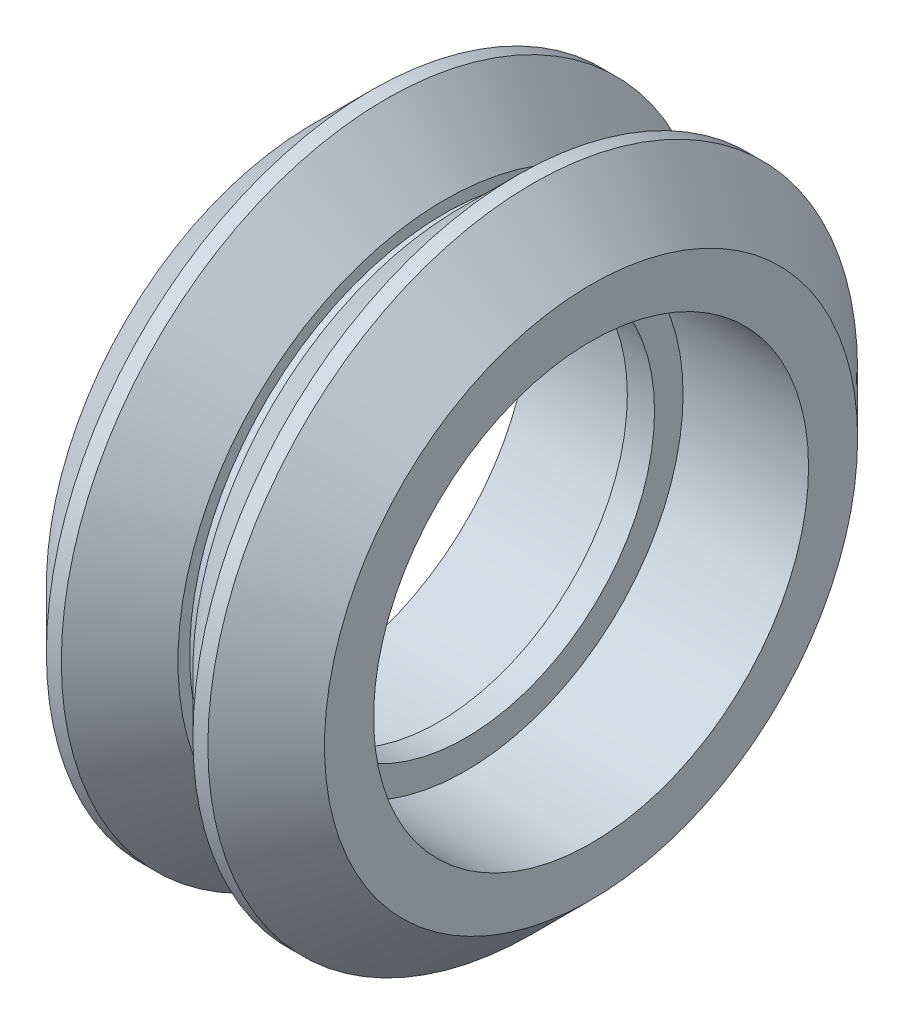
from build123d import *


with BuildPart() as part:
    # Sketch1 → Revolve1 (revolve)
    with BuildSketch(Plane.XY, mode=Mode.PRIVATE) as revolve1_sk:
        Polygon((0.5, 6.95), (-0.5, 6.95), (-0.5, 8), (-5.115, 8), (-5.115, 9.805), (-2.97, 11.95), (-2.42, 11.95), (-0.275, 9.805), (-0.275, 9.375), (0.275, 9.375), (0.275, 9.805), (2.42, 11.95), (2.97, 11.95), (5.115, 9.805), (5.115, 8), (0.5, 8), align=None)
    revolve(revolve1_sk.sketch.rotate(Axis((0, 0, 0), (-1, 0, 0)), 90), axis=Axis((0, 0, 0), (-1, 0, 0)))


solid = part.part
